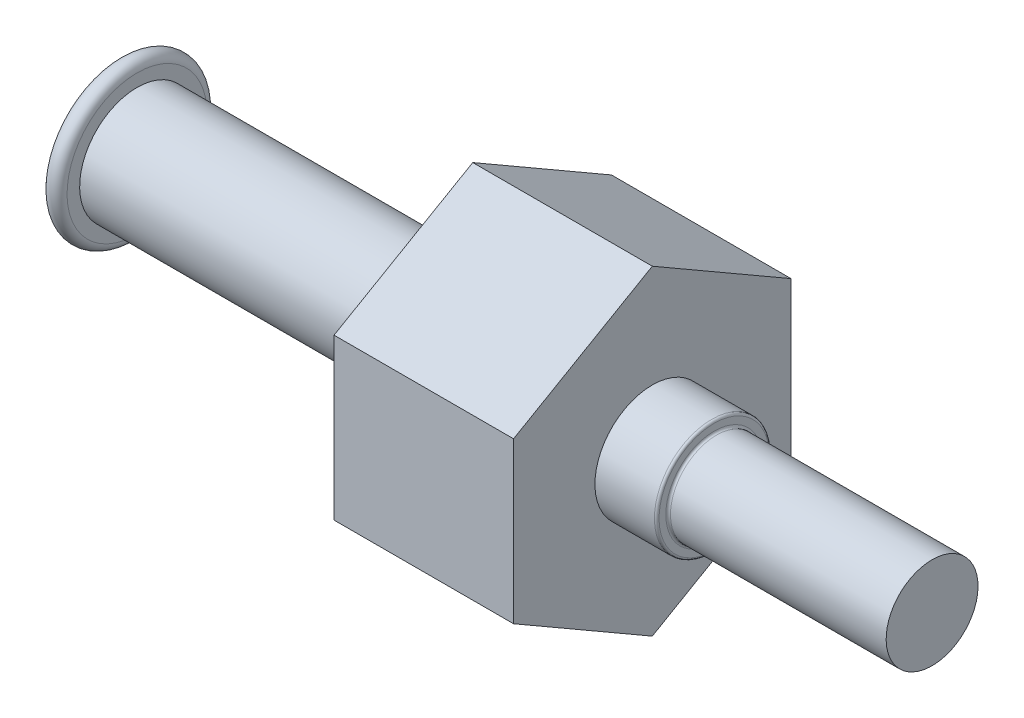
from build123d import *

# Parameters (mm, degrees)
BOSS_EXTRUDE1_DEPTH = 7.7


with BuildPart() as part:
    # Sketch1 → Revolve1 (revolve)
    with BuildSketch(Plane.XY):
        with BuildLine():
            Line((0, 2.46), (0, 3))
            ThreePointArc((0, 3), (-0.31335038, 3.369897721), (-0.72972973, 3.121621622))
            ThreePointArc((-0.72972973, 3.121621622), (-1.119041517, 1.582340253), (-1.25, 0))
            Line((-1.25, 0), (34.1, 0))
            Line((34.1, 0), (34.1, 1.97))
            Line((34.1, 1.97), (24.85, 1.97))
            ThreePointArc((24.85, 1.97), (24.779289322, 1.999289322), (24.75, 2.07))
            Line((24.75, 2.07), (24.75, 2.36))
            ThreePointArc((24.75, 2.36), (24.720710678, 2.430710678), (24.65, 2.46))
            Line((24.65, 2.46), (0, 2.46))
        make_face()
    revolve(axis=Axis((34.1, 0, 0), (-1, 0, 0)))

    # Sketch2 → Boss-Extrude1 (add)
    with BuildSketch(Plane(origin=(22.1, 0, 0), x_dir=(0, 0, -1), z_dir=(1, 0, 0))):
        Polygon((-5.95, 3.435234102), (-5.95, -3.435234102), (0, -6.870468203), (5.95, -3.435234102), (5.95, 3.435234102), (0, 6.870468203), align=None)
    extrude(amount=-BOSS_EXTRUDE1_DEPTH)


solid = part.part
